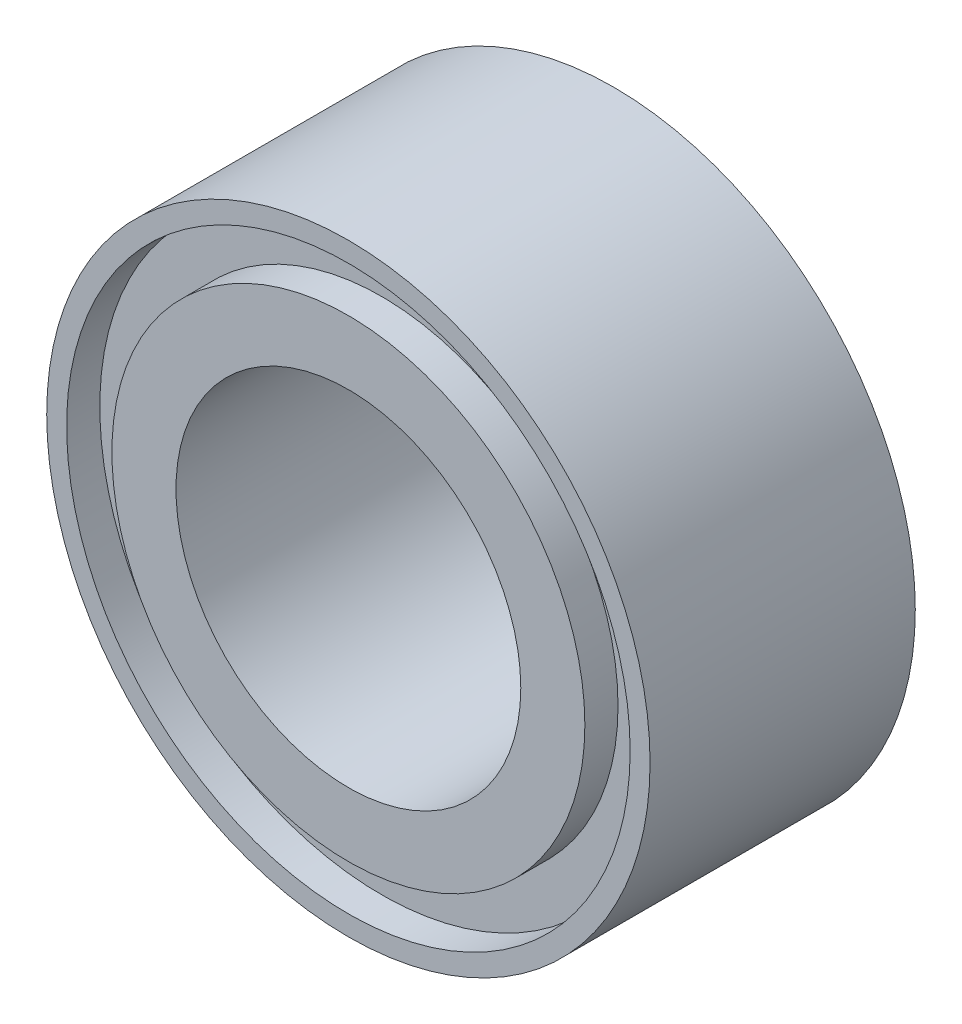
from build123d import *

# Parameters (mm, degrees)
SKETCH1_R           = 45.5
SKETCH1_R_2         = 26
BOSS_EXTRUDE1_DEPTH = 20
SKETCH2_R           = 42.493578565
SKETCH2_R_2         = 35.665645311
CUT_EXTRUDE2_DEPTH  = 5


with BuildPart() as part:
    # Sketch1 → Boss-Extrude1 (new body)
    with BuildSketch(Plane.XY):
        Circle(SKETCH1_R)
        Circle(SKETCH1_R_2, mode=Mode.SUBTRACT)
    boss_extrude1 = extrude(amount=BOSS_EXTRUDE1_DEPTH)

    # Sketch2 → Cut-Extrude2 (cut)
    with BuildSketch(Plane.XY.offset(20)):
        Circle(SKETCH2_R)
        Circle(SKETCH2_R_2, mode=Mode.SUBTRACT)
    cut_extrude2 = extrude(amount=-CUT_EXTRUDE2_DEPTH, mode=Mode.SUBTRACT)


with BuildPart() as mirror1_1:
    # Mirror1: Boss-Extrude1 across Front Plane
    add(boss_extrude1.mirror(Plane.XY))

    # Mirror1 2: Cut-Extrude2 across Front Plane
    add(cut_extrude2.mirror(Plane.XY), mode=Mode.SUBTRACT)


with BuildPart() as part_1:
    add(part.part)

    # Mirror1 united with what the copies touc: union Mirror1_1
    add(mirror1_1.part)


solid = part_1.part
